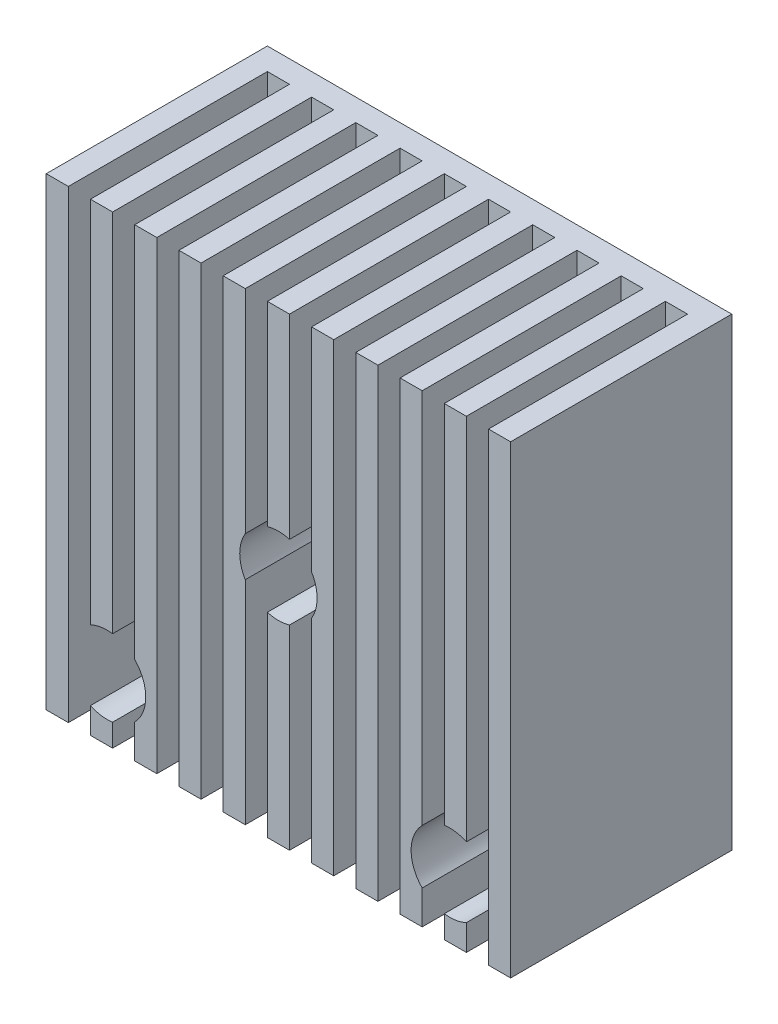
from build123d import *

# Parameters (mm, degrees)
SKETCH1_W               = 42
SKETCH1_H               = 42
BOSS_EXTRUDE1_DEPTH     = 20
CUT_EXTRUDE6_DEPTH      = 63.673758464
CUT_EXTRUDE6_DEPTH_BACK = 42
SKETCH7_W               = 2
SKETCH7_H               = 18
SKETCH8_R               = 1.6
SKETCH8_R_2             = 3.5
CUT_EXTRUDE7_DEPTH      = 2
CUT_EXTRUDE8_START      = -18
SKETCH10_R              = 3.5
CUT_EXTRUDE8_DEPTH      = 18


with BuildPart() as part:
    # Sketch1 → Boss-Extrude1 (new body)
    with BuildSketch(Plane.XY):
        with Locations((21, 21)):
            Rectangle(SKETCH1_W, SKETCH1_H)
    extrude(amount=BOSS_EXTRUDE1_DEPTH)

    # Sketch7 → Cut-Extrude6 (cut, two sides: drawn at the far end of the back side and taken through both)
    with BuildSketch(Plane(origin=(0, 42, 0), x_dir=(1, 0, 0), z_dir=(0, 1, 0)).offset(-CUT_EXTRUDE6_DEPTH_BACK)):
        with Locations((39, -11)):
            Rectangle(SKETCH7_W, SKETCH7_H)
        with Locations((35, -11)):
            Rectangle(SKETCH7_W, SKETCH7_H)
        with Locations((3, -11)):
            Rectangle(SKETCH7_W, SKETCH7_H)
        with Locations((31, -11)):
            Rectangle(SKETCH7_W, SKETCH7_H)
        with Locations((7, -11)):
            Rectangle(SKETCH7_W, SKETCH7_H)
        with Locations((27, -11)):
            Rectangle(SKETCH7_W, SKETCH7_H)
        with Locations((11, -11)):
            Rectangle(SKETCH7_W, SKETCH7_H)
        with Locations((23, -11)):
            Rectangle(SKETCH7_W, SKETCH7_H)
        with Locations((15, -11)):
            Rectangle(SKETCH7_W, SKETCH7_H)
        with Locations((19, -11)):
            Rectangle(SKETCH7_W, SKETCH7_H)
    extrude(amount=CUT_EXTRUDE6_DEPTH + CUT_EXTRUDE6_DEPTH_BACK, mode=Mode.SUBTRACT)

    # Sketch8 → Cut-Extrude7 (cut)
    with BuildSketch(Plane(origin=(0, 0, 0), x_dir=(-1, 0, 0), z_dir=(0, 0, -1))):
        with Locations((-36.5, 5.5)):
            Circle(SKETCH8_R)
        with Locations(Location((-5.5, 5.5, 0), (0, 0, 20.364134806))):
            Circle(SKETCH8_R)
        with Locations((-21, 21)):
            Circle(SKETCH8_R_2)
    extrude(amount=-CUT_EXTRUDE7_DEPTH, mode=Mode.SUBTRACT)

    # Sketch10 → Cut-Extrude8 (cut)
    with BuildSketch(Plane.XY.offset(20).offset(CUT_EXTRUDE8_START)):
        with Locations((36.5, 5.5)):
            Circle(SKETCH10_R)
        with Locations((5.5, 5.5)):
            Circle(SKETCH10_R)
        with Locations(Location((21, 21, 0), (0, 0, 180))):
            Circle(SKETCH10_R)
    extrude(amount=CUT_EXTRUDE8_DEPTH, mode=Mode.SUBTRACT)


solid = part.part
